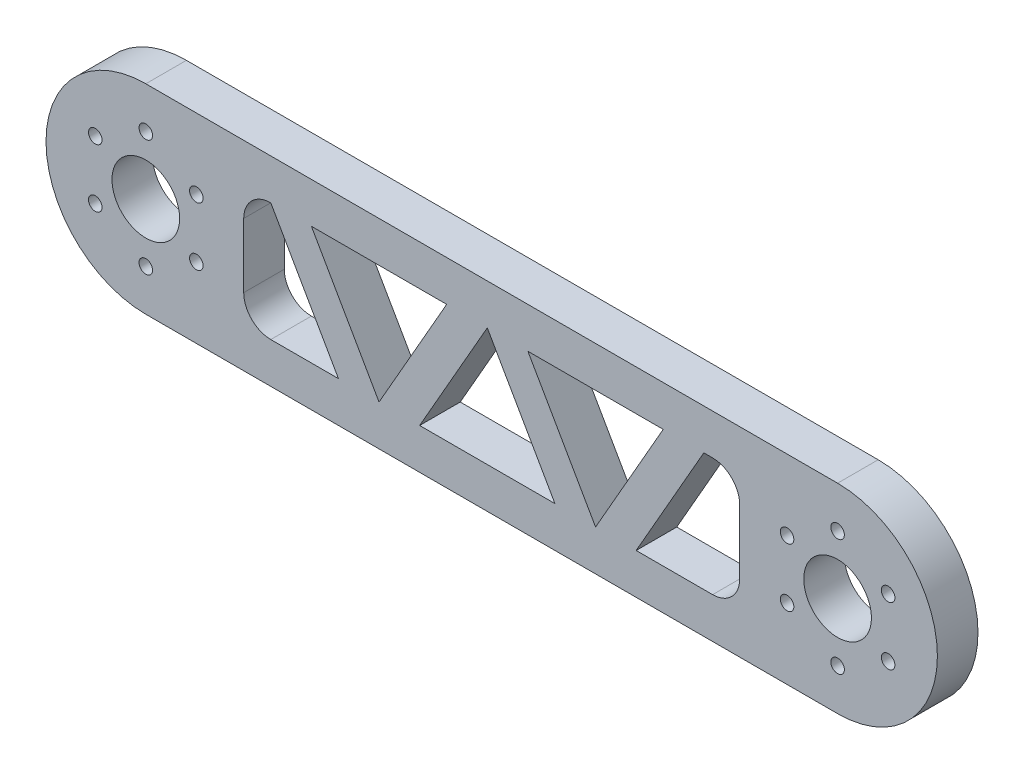
from build123d import *

# Parameters (mm, degrees)
BOSS_EXTRUDE2_DEPTH = 12
SKETCH2_R           = 2
CUT_EXTRUDE1_DEPTH  = 12
CIRPATTERN1_COUNT   = 6
SKETCH4_R           = 2
CUT_EXTRUDE2_DEPTH  = 12
CIRPATTERN2_COUNT   = 6
CUT_EXTRUDE4_DEPTH  = 12
SKETCH8_R           = 10
CUT_EXTRUDE5_DEPTH  = 12
SKETCH9_R           = 10
CUT_EXTRUDE6_DEPTH  = 12
SKETCH10_R          = 3.75
CUT_EXTRUDE7_DEPTH  = 6
CIRPATTERN3_COUNT   = 6
SKETCH11_R          = 3.75
CUT_EXTRUDE8_DEPTH  = 6
CIRPATTERN4_COUNT   = 6


with BuildPart() as part:
    # Sketch1 → Boss-Extrude2 (new body)
    with BuildSketch(Plane.XY):
        with BuildLine():
            Line((0, 29.5), (204.48, 29.5))
            ThreePointArc((204.48, 29.5), (233.98, 0), (204.48, -29.5))
            Line((204.48, -29.5), (0, -29.5))
            ThreePointArc((0, -29.5), (-29.5, 0), (0, 29.5))
        make_face()
    extrude(amount=-BOSS_EXTRUDE2_DEPTH)

    # Sketch2 → Cut-Extrude1 (cut)
    with BuildSketch(Plane.XY):
        with Locations((0, 17.25)):
            Circle(SKETCH2_R)
    cut_extrude1 = extrude(amount=-CUT_EXTRUDE1_DEPTH, mode=Mode.SUBTRACT)

    # CirPattern1: Cut-Extrude1 ×6 about axis
    cirpattern1_axis = Axis((0, 0, 0), (0, 0, 1))
    for i in range(1, CIRPATTERN1_COUNT):
        add(cut_extrude1.rotate(cirpattern1_axis, i * 360 / CIRPATTERN1_COUNT), mode=Mode.SUBTRACT)

    # Sketch4 → Cut-Extrude2 (cut)
    with BuildSketch(Plane.XY):
        with Locations((204.48, 17.25)):
            Circle(SKETCH4_R)
    cut_extrude2 = extrude(amount=-CUT_EXTRUDE2_DEPTH, mode=Mode.SUBTRACT)

    # CirPattern2: Cut-Extrude2 ×6 about axis
    cirpattern2_axis = Axis((204.48, 0, 0), (0, 0, 1))
    for i in range(1, CIRPATTERN2_COUNT):
        add(cut_extrude2.rotate(cirpattern2_axis, i * 360 / CIRPATTERN2_COUNT), mode=Mode.SUBTRACT)

    # Sketch7 → Cut-Extrude4 (cut)
    with BuildSketch(Plane.XY):
        with BuildLine():
            Line((56.938938215, -17.5), (36.938938215, 17.5))
            ThreePointArc((36.938938215, 17.5), (31.282083966, 15.156854249), (28.938938215, 9.5))
            Line((28.938938215, 9.5), (28.938938215, -9.5))
            ThreePointArc((28.938938215, -9.5), (31.282083966, -15.156854249), (36.938938215, -17.5))
            Line((36.938938215, -17.5), (56.938938215, -17.5))
        make_face()
        Polygon((88.938938215, 17.5), (48.938938215, 17.5), (68.938938215, -17.5), align=None)
        Polygon((120.938938215, -17.5), (100.938938215, 17.5), (80.938938215, -17.5), align=None)
        Polygon((152.938938215, 17.5), (112.938938215, 17.5), (132.938938215, -17.5), align=None)
        with BuildLine():
            Line((167.541061785, 17.5), (164.938938215, 17.5))
            Line((164.938938215, 17.5), (144.938938215, -17.5))
            Line((144.938938215, -17.5), (167.541061785, -17.5))
            ThreePointArc((167.541061785, -17.5), (173.197916034, -15.156854249), (175.541061785, -9.5))
            Line((175.541061785, -9.5), (175.541061785, 9.5))
            ThreePointArc((175.541061785, 9.5), (173.197916034, 15.156854249), (167.541061785, 17.5))
        make_face()
    extrude(amount=-CUT_EXTRUDE4_DEPTH, mode=Mode.SUBTRACT)

    # Sketch8 → Cut-Extrude5 (cut)
    with BuildSketch(Plane.XY):
        Circle(SKETCH8_R)
    extrude(amount=-CUT_EXTRUDE5_DEPTH, mode=Mode.SUBTRACT)

    # Sketch9 → Cut-Extrude6 (cut)
    with BuildSketch(Plane.XY):
        with Locations((204.48, 0)):
            Circle(SKETCH9_R)
    extrude(amount=-CUT_EXTRUDE6_DEPTH, mode=Mode.SUBTRACT)

    # Sketch10 → Cut-Extrude7 (cut)
    with BuildSketch(Plane(origin=(0, 0, -12), x_dir=(-1, 0, 0), z_dir=(0, 0, -1))):
        with Locations((-204.48, 17.25)):
            Circle(SKETCH10_R)
    cut_extrude7 = extrude(amount=-CUT_EXTRUDE7_DEPTH, mode=Mode.SUBTRACT)

    # CirPattern3: Cut-Extrude7 ×6 about axis
    cirpattern3_axis = Axis((204.48, 0, 0), (0, 0, 1))
    for i in range(1, CIRPATTERN3_COUNT):
        add(cut_extrude7.rotate(cirpattern3_axis, i * 360 / CIRPATTERN3_COUNT), mode=Mode.SUBTRACT)

    # Sketch11 → Cut-Extrude8 (cut)
    with BuildSketch(Plane(origin=(0, 0, -12), x_dir=(-1, 0, 0), z_dir=(0, 0, -1))):
        with Locations((0, 17.25)):
            Circle(SKETCH11_R)
    cut_extrude8 = extrude(amount=-CUT_EXTRUDE8_DEPTH, mode=Mode.SUBTRACT)

    # CirPattern4: Cut-Extrude8 ×6 about axis
    cirpattern4_axis = Axis((0, 0, 0), (0, 0, 1))
    for i in range(1, CIRPATTERN4_COUNT):
        add(cut_extrude8.rotate(cirpattern4_axis, i * 360 / CIRPATTERN4_COUNT), mode=Mode.SUBTRACT)


solid = part.part
